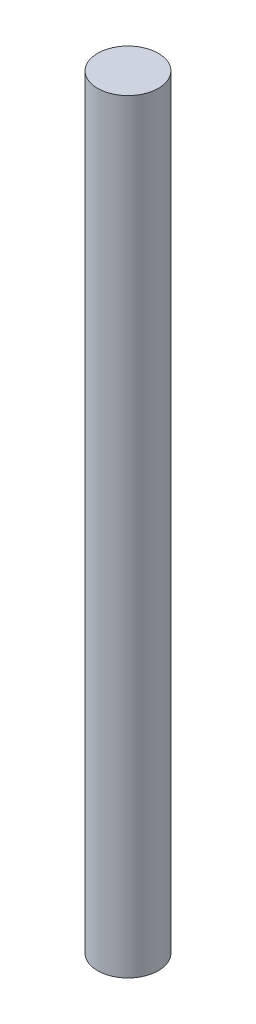
from build123d import *

# Parameters (mm, degrees)
ESBO_O1_R                = 2.385
RESSALTO_EXTRUS_O2_DEPTH = 60


with BuildPart() as part:
    # Esboço1 → Ressalto-extrusão2 (new body)
    with BuildSketch(Plane(origin=(0, 0, 0), x_dir=(1, 0, 0), z_dir=(0, 1, 0))):
        with Locations(Location((0, 0, 0), (0, 0, 270))):
            Circle(ESBO_O1_R)
    extrude(amount=RESSALTO_EXTRUS_O2_DEPTH)


solid = part.part
